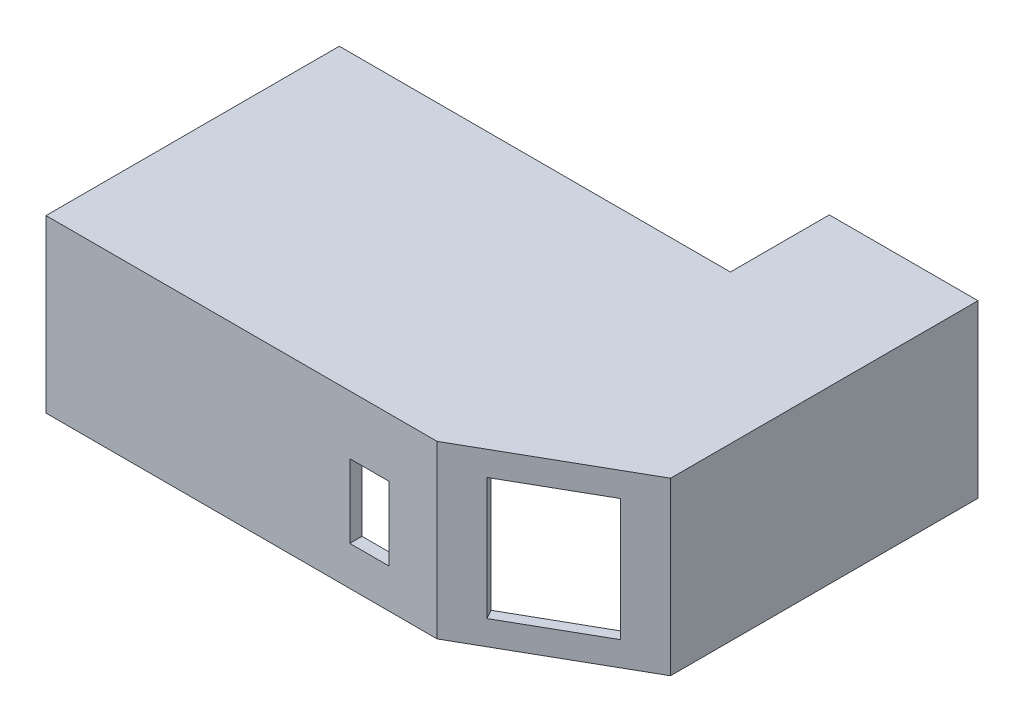
from build123d import *

# Parameters (mm, degrees)
Y_KSEKLIK_EKSTR_ZYON1_DEPTH = 35
KES_EKSTR_ZYON2_DEPTH       = 32.5
IZIM6_W                     = 20
IZIM6_H                     = 25
KES_EKSTR_ZYON3_DEPTH       = 12.5
IZIM7_R                     = 3.5
KES_EKSTR_ZYON4_DEPTH       = 12.5
IZIM8_W                     = 8
IZIM8_H                     = 15
KES_EKSTR_ZYON5_DEPTH       = 12.5


with BuildPart() as part:
    # Çizim1 → Yükseklik-Ekstrüzyon1 (new body)
    with BuildSketch(Plane(origin=(0, 0, 0), x_dir=(1, 0, 0), z_dir=(0, 1, 0))):
        Polygon((80, 0), (110.4139872, 17.348793327), (110.4139872, 60), (110.4139872, 80.241023143), (80, 80.241023143), (80, 60), (0, 60), (0, 0), align=None)
    extrude(amount=Y_KSEKLIK_EKSTR_ZYON1_DEPTH)

    # Çizim5 → Kes-Ekstrüzyon2 (cut)
    with BuildSketch(Plane(origin=(0, 0, 0), x_dir=(-1, 0, 0), z_dir=(0, -1, 0))):
        Polygon((-2.5, 2.5), (-80, 2.5), (-107.9139872, 18.34615917), (-107.9139872, 77.741023143), (-82.5, 77.741023143), (-82.5, 57.5), (-80.013539943, 57.5), (-2.5, 57.5), align=None)
    extrude(amount=-KES_EKSTR_ZYON2_DEPTH, mode=Mode.SUBTRACT)

    # Çizim6 → Kes-Ekstrüzyon3 (cut)
    with BuildSketch(Plane(origin=(19.639985559, 0, 34.430652215), x_dir=(0.8686196984341679, 0, -0.4954793835187649), z_dir=(0.4954793835187649, 0, 0.8686196984341679))):
        with Locations((86.989575875, 17.5)):
            Rectangle(IZIM6_W, IZIM6_H)
    extrude(amount=-KES_EKSTR_ZYON3_DEPTH, mode=Mode.SUBTRACT)

    # Çizim7 → Kes-Ekstrüzyon4 (cut)
    with BuildSketch(Plane(origin=(0, 0, -80.241023143), x_dir=(-1, 0, 0), z_dir=(0, 0, -1))):
        with Locations((-97.4139872, 17.5)):
            Circle(IZIM7_R)
    extrude(amount=-KES_EKSTR_ZYON4_DEPTH, mode=Mode.SUBTRACT)

    # Çizim8 → Kes-Ekstrüzyon5 (cut)
    with BuildSketch(Plane.XY):
        with Locations((66.154872496, 15.5)):
            Rectangle(IZIM8_W, IZIM8_H)
    extrude(amount=-KES_EKSTR_ZYON5_DEPTH, mode=Mode.SUBTRACT)


solid = part.part
